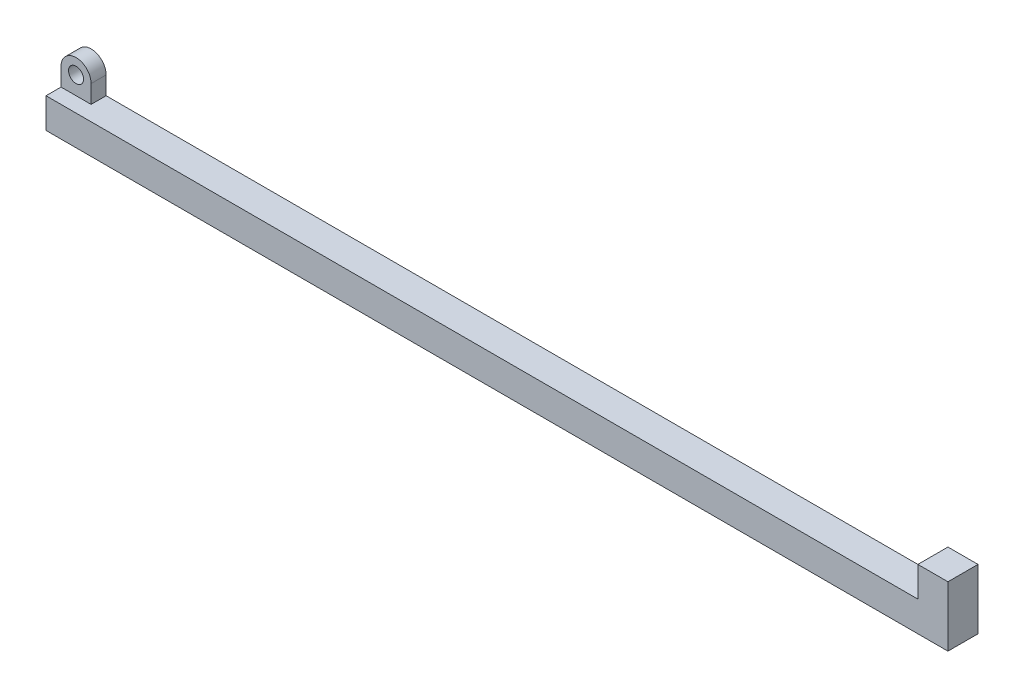
from build123d import *

# Parameters (mm, degrees)
SKETCH_1_R          = 25
EXTRUDE_1_DEPTH     = 100
SKETCH_2_W          = 140.942961324
SKETCH_2_H          = 134.262185151
CUT_EXTRUDE_1_DEPTH = 50


with BuildPart() as part:
    # 草图1 → 拉伸1 (new body)
    with BuildSketch(Plane.XY):
        with BuildLine():
            Line((-50, -160), (2950, -160))
            Line((2950, -160), (2950, 40))
            Line((2950, 40), (2850, 40))
            Line((2850, 40), (2850, -60))
            Line((2850, -60), (50, -60))
            Line((50, -60), (50, 0))
            ThreePointArc((50, 0), (0, 50), (-50, 0))
            Line((-50, 0), (-50, -160))
        make_face()
        Circle(SKETCH_1_R, mode=Mode.SUBTRACT)
    extrude(amount=EXTRUDE_1_DEPTH)

    # 草图2 → 切除-拉伸1 (cut)
    with BuildSketch(Plane.XY.offset(100)):
        with Locations((-20.471480662, 7.131092576)):
            Rectangle(SKETCH_2_W, SKETCH_2_H)
    extrude(amount=-CUT_EXTRUDE_1_DEPTH, mode=Mode.SUBTRACT)


solid = part.part
